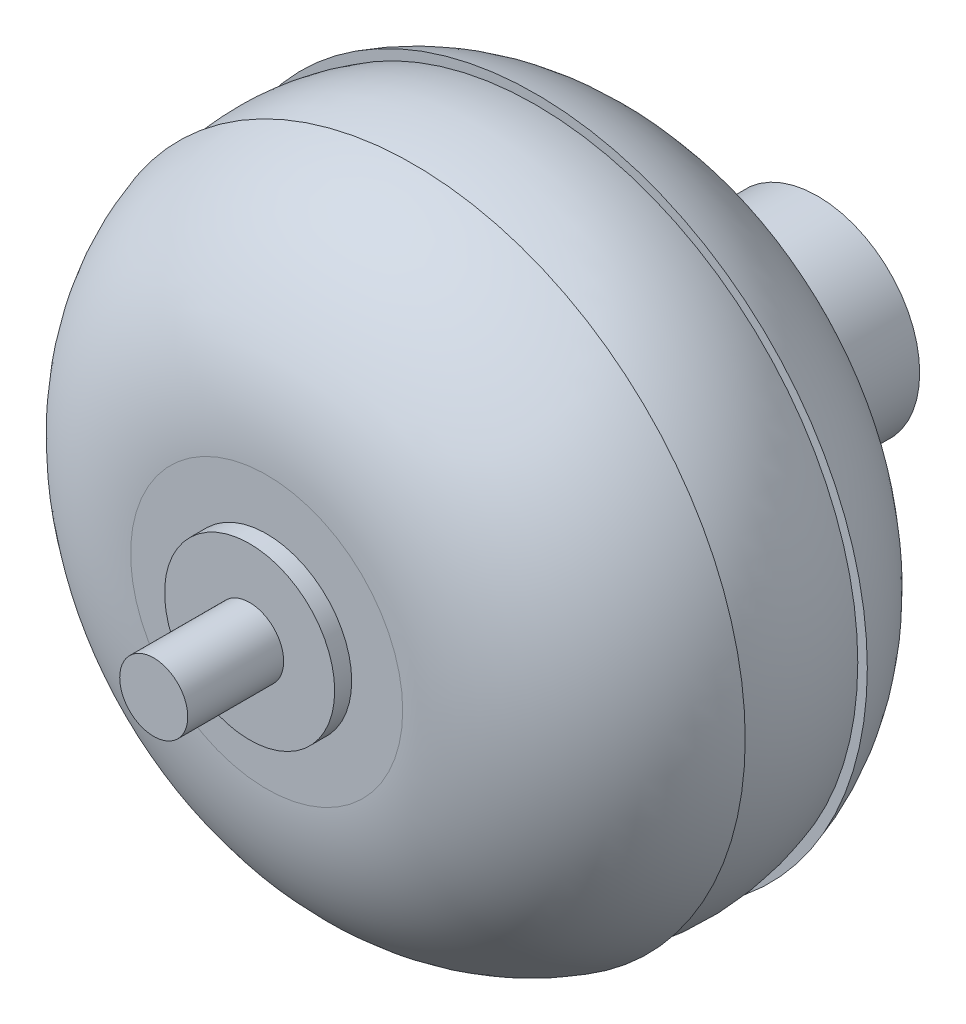
from build123d import *

# Parameters (mm, degrees)
SKETCH1_R           = 10
BOSS_EXTRUDE1_DEPTH = 12.2
SKETCH4_R           = 2.5
BOSS_EXTRUDE3_DEPTH = 0.5
SKETCH5_R           = 1
BOSS_EXTRUDE4_DEPTH = 3.32
FILLET1_R           = 6
SKETCH2_R           = 3
BOSS_EXTRUDE2_DEPTH = 4
SKETCH6_R           = 2.02
CUT_EXTRUDE1_DEPTH  = 2.5


with BuildPart() as part:
    # Sketch1 → Boss-Extrude1 (new body)
    with BuildSketch(Plane.XY):
        Circle(SKETCH1_R)
    extrude(amount=BOSS_EXTRUDE1_DEPTH)

    # Sketch4 → Boss-Extrude3 (add)
    with BuildSketch(Plane.XY.offset(12.2)):
        Circle(SKETCH4_R)
    extrude(amount=BOSS_EXTRUDE3_DEPTH)

    # Sketch5 → Boss-Extrude4 (add)
    with BuildSketch(Plane.XY.offset(12.2)):
        with Locations(Location((0, 0, 0), (0, 0, 180))):
            Circle(SKETCH5_R)
    extrude(amount=BOSS_EXTRUDE4_DEPTH)

    # Fillet1
    fillet1_edges = [part.edges().sort_by_distance(p)[0] for p in [
        (-10, 0, 0),
        (-10, 0, 12.2),
    ]]
    fillet(fillet1_edges, radius=FILLET1_R)

    # Sketch2 → Boss-Extrude2 (add)
    with BuildSketch(Plane(origin=(0, 0, 0), x_dir=(-1, 0, 0), z_dir=(0, 0, -1))):
        with Locations(Location((0, 0, 0), (0, 0, 180))):
            Circle(SKETCH2_R)
    extrude(amount=BOSS_EXTRUDE2_DEPTH)

    # Sketch6 → Cut-Extrude1 (cut)
    with BuildSketch(Plane(origin=(0, 0, -4), x_dir=(-1, 0, 0), z_dir=(0, 0, -1))):
        Circle(SKETCH6_R)
    extrude(amount=-CUT_EXTRUDE1_DEPTH, mode=Mode.SUBTRACT)

    # Sketch7 → Cut-Revolve1 (revolve, cut)
    with BuildSketch(Plane(origin=(0, 0, 0), x_dir=(0, 0, -1), z_dir=(1, 0, 0)), mode=Mode.PRIVATE) as cut_revolve1_sk:
        with BuildLine():
            Line((-7.887262955, 10.599100827), (-4.29107992, 10.599100827))
            Line((-4.29107992, 10.599100827), (-4.29107992, 9.471207056))
            ThreePointArc((-4.29107992, 9.471207056), (-6.089171437, 9.757850623), (-7.887262955, 9.471207056))
            Line((-7.887262955, 9.471207056), (-7.887262955, 10.599100827))
        make_face()
    revolve(cut_revolve1_sk.sketch.rotate(Axis((0, 0, 15.193399994), (0, 0, -1)), 90), axis=Axis((0, 0, 15.193399994), (0, 0, -1)), mode=Mode.SUBTRACT)


solid = part.part
